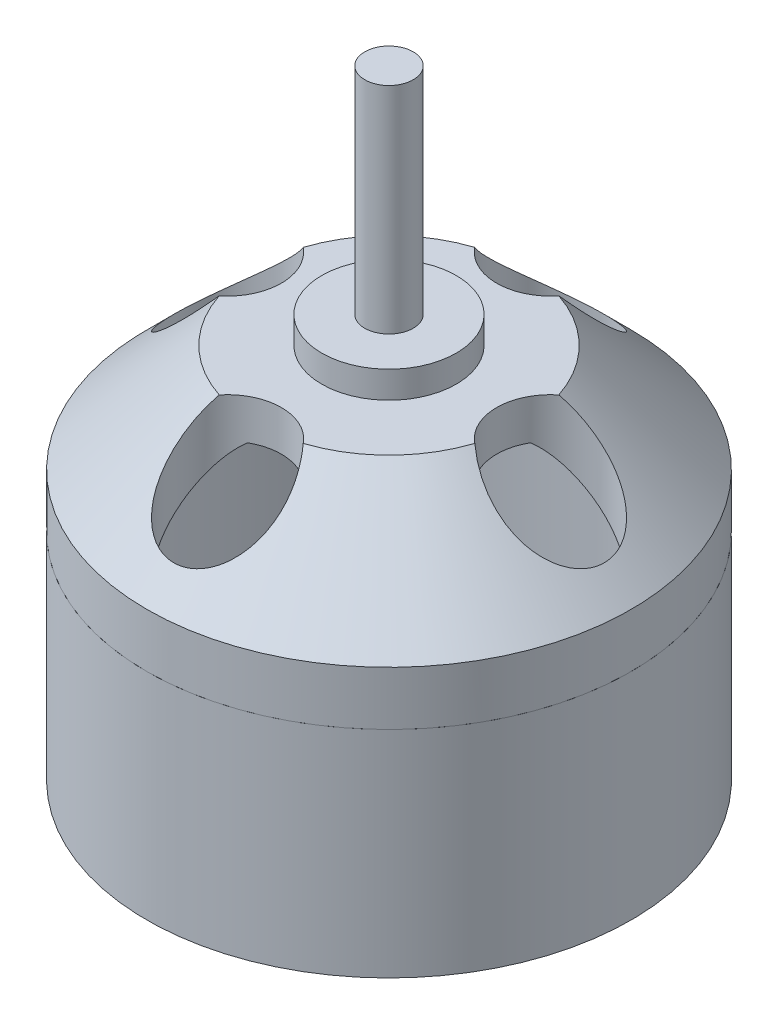
from build123d import *

# Parameters (mm, degrees)
IZIM2_R                          = 9
Y_KSEKLIK_EKSTR_ZYON1_DEPTH      = 1
IZIM3_R                          = 9
Y_KSEKLIK_EKSTR_ZYON2_DEPTH      = 5
PAH1_SIZE                        = 4
BO_ALTMA1_T                      = -1.5
IZIM5_R                          = 2
KES_EKSTR_ZYON1_DEPTH            = 6
IZIM7_R                          = 2.5
Y_KSEKLIK_EKSTR_ZYON4_DEPTH      = 1
IZIM6_R                          = 9
IZIM6_R_2                        = 8.5
Y_KSEKLIK_EKSTR_ZYON6_DEPTH      = 8
Y_KSEKLIK_EKSTR_ZYON7_DEPTH      = 8
Y_KSEKLIK_EKSTR_ZYON7_DEPTH_BACK = 20
IZIM8_R                          = 0.9


with BuildPart() as part:
    # Çizim2 → Yükseklik-Ekstrüzyon1 (new body)
    with BuildSketch(Plane(origin=(0, 0, 0), x_dir=(1, 0, 0), z_dir=(0, 1, 0))):
        with Locations(Location((0, 0, 0), (0, 0, 270))):
            Circle(IZIM2_R)
    extrude(amount=Y_KSEKLIK_EKSTR_ZYON1_DEPTH)

    # Çizim3 → Yükseklik-Ekstrüzyon2 (add)
    with BuildSketch(Plane(origin=(0, 1, 0), x_dir=(1, 0, 0), z_dir=(0, 1, 0))):
        with Locations(Location((0, 0, 0), (0, 0, 270))):
            Circle(IZIM3_R)
    extrude(amount=Y_KSEKLIK_EKSTR_ZYON2_DEPTH)

    # Pah1
    pah1_edges = [part.edges().sort_by_distance(p)[0] for p in [
        (0, 6, -9),
    ]]
    chamfer(pah1_edges, length=PAH1_SIZE)

    # İç Boşaltma1
    bo_altma1_openings = [part.faces().sort_by_distance(p)[0] for p in [
        (0, 0, 0),
    ]]
    offset(amount=BO_ALTMA1_T, openings=bo_altma1_openings, kind=Kind.INTERSECTION)

    # Çizim5 → Kes-Ekstrüzyon1 (cut)
    with BuildSketch(Plane(origin=(0, 6, 0), x_dir=(1, 0, 0), z_dir=(0, 1, 0))):
        with Locations(Location((0, -6, 0), (0, 0, 317.383857291))):
            Circle(IZIM5_R)
        with Locations(Location((-6, 0, 0), (0, 0, 308.682187453))):
            Circle(IZIM5_R)
        with Locations(Location((0, 6, 0), (0, 0, 240.203813537))):
            Circle(IZIM5_R)
        with Locations(Location((6, 0, 0), (0, 0, 231.317810635))):
            Circle(IZIM5_R)
    extrude(amount=-KES_EKSTR_ZYON1_DEPTH, mode=Mode.SUBTRACT)

    # Çizim7 → Yükseklik-Ekstrüzyon4 (add)
    with BuildSketch(Plane(origin=(0, 6, 0), x_dir=(1, 0, 0), z_dir=(0, 1, 0))):
        with Locations(Location((0, 0, 0), (0, 0, 270))):
            Circle(IZIM7_R)
    extrude(amount=Y_KSEKLIK_EKSTR_ZYON4_DEPTH)


with BuildPart() as body_2:
    # Çizim6 → Yükseklik-Ekstrüzyon6 (new body)
    with BuildSketch(Plane.XZ):
        with Locations(Location((0, 0, 0), (0, 0, 270))):
            Circle(IZIM6_R)
        with Locations(Location((0, 0, 0), (0, 0, 270))):
            Circle(IZIM6_R_2, mode=Mode.SUBTRACT)
    extrude(amount=Y_KSEKLIK_EKSTR_ZYON6_DEPTH)


with BuildPart() as body_3:
    # Çizim8 → Yükseklik-Ekstrüzyon7 (new, two sides: drawn at the far end of the back side and taken through both)
    with BuildSketch(Plane(origin=(0, 7, 0), x_dir=(1, 0, 0), z_dir=(0, 1, 0)).offset(-Y_KSEKLIK_EKSTR_ZYON7_DEPTH_BACK)):
        with Locations(Location((0, 0, 0), (0, 0, 270))):
            Circle(IZIM8_R)
    extrude(amount=Y_KSEKLIK_EKSTR_ZYON7_DEPTH + Y_KSEKLIK_EKSTR_ZYON7_DEPTH_BACK)


solid = Compound([part.part, body_2.part, body_3.part])
